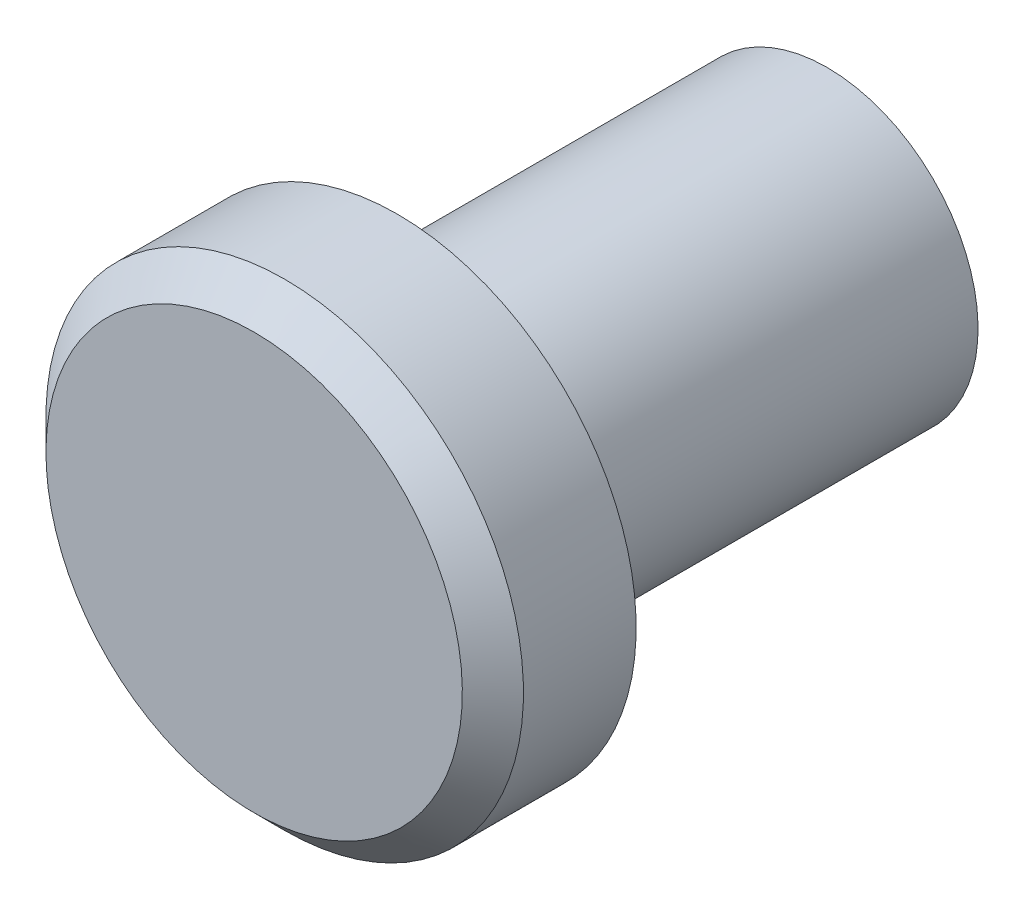
from build123d import *

# Parameters (mm, degrees)
CHAMFER1_SIZE = 0.8128


with BuildPart() as part:
    # Sketch1 → Revolve2 (revolve)
    with BuildSketch(Plane(origin=(0, 0, 0), x_dir=(0, 0, -1), z_dir=(1, 0, 0))):
        Polygon((0, 0), (0, 6.35), (3.81, 6.35), (3.81, 4.0132), (15.24, 4.0132), (15.24, 2.921), (4.445, 2.921), (1.524, 0), align=None)
    revolve(axis=Axis((0, 0, -1.524), (0, 0, 1)))

    # Chamfer1
    chamfer1_edges = [part.edges().sort_by_distance(p)[0] for p in [
        (0, -2.921, -15.24),
        (0, -6.35, 0),
    ]]
    chamfer(chamfer1_edges, length=CHAMFER1_SIZE)


solid = part.part
